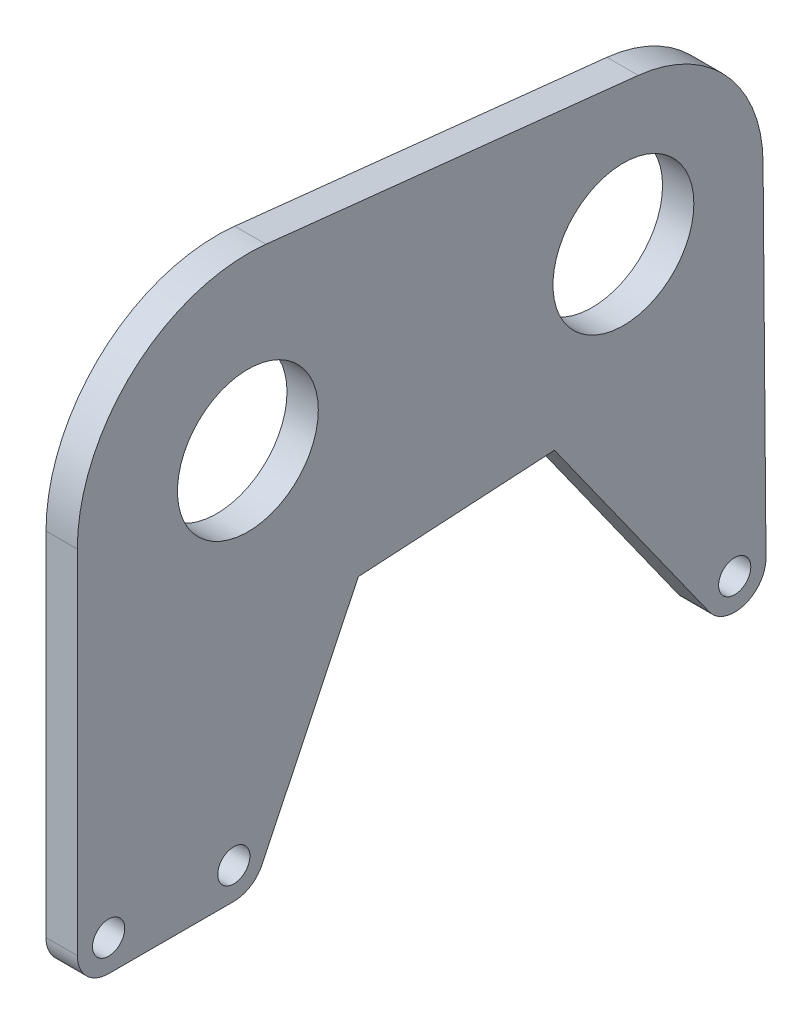
from build123d import *

# Parameters (mm, degrees)
SKETCH2_R           = 34.599541738
SKETCH2_R_2         = 14.2875
SKETCH2_R_3         = 6.35
SKETCH2_R_4         = 3.2639
SKETCH2_R_5         = 28.329529504
BOSS_EXTRUDE2_DEPTH = 6.35


with BuildPart() as part:
    # Sketch2 → Boss-Extrude2 (new body)
    # profile 1 of 10: a face of its own
    with BuildSketch(Plane(origin=(0, 0, 0), x_dir=(0, 0, -1), z_dir=(1, 0, 0))):
        with Locations((54.99261314, -31.75)):
            Circle(SKETCH2_R)
        with Locations((54.99261314, -31.75)):
            Circle(SKETCH2_R_2, mode=Mode.SUBTRACT)
    # profile 2 of 10: a face of its own
    with BuildSketch(Plane(origin=(0, 0, 0), x_dir=(0, 0, -1), z_dir=(1, 0, 0))):
        with BuildLine():
            ThreePointArc((57.000696707, -66.291220141), (31.247618749, -56.915522641), (20.393071403, -31.75))
            Line((20.393071403, -31.75), (20.393071403, -103.183274949))
            ThreePointArc((20.393071403, -103.183274949), (26.743071403, -96.833274949), (33.093071403, -103.183274949))
            ThreePointArc((33.093071403, -103.183274949), (31.233199463, -107.67340301), (26.743071403, -109.533274949))
            Line((26.743071403, -109.533274949), (52.143071403, -109.533274949))
            ThreePointArc((52.143071403, -109.533274949), (47.652943342, -98.693146889), (58.493071403, -103.183274949))
            ThreePointArc((58.493071403, -103.183274949), (58.33576166, -104.587941235), (57.87162656, -105.923011398))
            Line((57.87162656, -105.923011398), (77.392896244, -65.105702067))
            Line((77.392896244, -65.105702067), (57.000696707, -66.291220141))
        make_face()
    # profile 3 of 10: a face of its own
    with BuildSketch(Plane(origin=(0, 0, 0), x_dir=(0, 0, -1), z_dir=(1, 0, 0))):
        with Locations((52.143071403, -103.183274949)):
            Circle(SKETCH2_R_3)
        with Locations((52.143071403, -103.183274949)):
            Circle(SKETCH2_R_4, mode=Mode.SUBTRACT)
    # profile 4 of 10: a face of its own
    with BuildSketch(Plane(origin=(0, 0, 0), x_dir=(0, 0, -1), z_dir=(1, 0, 0))):
        with Locations((26.743071403, -103.183274949)):
            Circle(SKETCH2_R_3)
        with Locations((26.743071403, -103.183274949)):
            Circle(SKETCH2_R_4, mode=Mode.SUBTRACT)
    # profile 5 of 10: a face of its own
    with BuildSketch(Plane(origin=(0, 0, 0), x_dir=(0, 0, -1), z_dir=(1, 0, 0))):
        with Locations((131.170104981, -33.601954858)):
            Circle(SKETCH2_R_5)
        with Locations((131.170104981, -33.601954858)):
            Circle(SKETCH2_R_2, mode=Mode.SUBTRACT)
    # profile 6 of 10: a face of its own
    with BuildSketch(Plane(origin=(0, 0, 0), x_dir=(0, 0, -1), z_dir=(1, 0, 0))):
        with BuildLine():
            Line((134.186655208, -5.433485487), (58.676799121, 2.652835088))
            ThreePointArc((58.676799121, 2.652835088), (80.727797568, -8.623639047), (89.592154878, -31.75))
            ThreePointArc((89.592154878, -31.75), (88.735013932, -39.403670834), (86.206059323, -46.678130018))
            Line((86.206059323, -46.678130018), (77.392896244, -65.105702067))
            Line((77.392896244, -65.105702067), (117.180043235, -62.792642027))
            Line((117.180043235, -62.792642027), (108.094917525, -50.036612316))
            ThreePointArc((108.094917525, -50.036612316), (106.717150914, -19.297575132), (134.186655208, -5.433485487))
        make_face()
    # profile 7 of 10: a face of its own
    with BuildSketch(Plane(origin=(0, 0, 0), x_dir=(0, 0, -1), z_dir=(1, 0, 0))):
        with BuildLine():
            ThreePointArc((86.206059323, -46.678130018), (74.282139722, -60.47355223), (57.000696707, -66.291220141))
            Line((57.000696707, -66.291220141), (77.392896244, -65.105702067))
            Line((77.392896244, -65.105702067), (86.206059323, -46.678130018))
        make_face()
    # profile 8 of 10: a face of its own
    with BuildSketch(Plane(origin=(0, 0, 0), x_dir=(0, 0, -1), z_dir=(1, 0, 0))):
        with BuildLine():
            ThreePointArc((132.814290418, -61.883731609), (118.926309787, -59.149004025), (108.094917525, -50.036612316))
            Line((108.094917525, -50.036612316), (117.180043235, -62.792642027))
            Line((117.180043235, -62.792642027), (132.814290418, -61.883731609))
        make_face()
    # profile 9 of 10: a face of its own
    with BuildSketch(Plane(origin=(0, 0, 0), x_dir=(0, 0, -1), z_dir=(1, 0, 0))):
        with BuildLine():
            Line((160.092841091, -103.129192537), (159.498606986, -33.360674656))
            ThreePointArc((159.498606986, -33.360674656), (159.49937761, -33.481313663), (159.499634486, -33.601954858))
            ThreePointArc((159.499634486, -33.601954858), (151.775216505, -53.043961468), (132.814290418, -61.883731609))
            Line((132.814290418, -61.883731609), (117.180043235, -62.792642027))
            Line((117.180043235, -62.792642027), (148.570820295, -106.867066268))
            ThreePointArc((148.570820295, -106.867066268), (151.78359124, -97.143164231), (160.092841091, -103.129192537))
        make_face()
    # profile 10 of 10: a face of its own
    with BuildSketch(Plane(origin=(0, 0, 0), x_dir=(0, 0, -1), z_dir=(1, 0, 0))):
        with Locations((153.743071403, -103.183274949)):
            Circle(SKETCH2_R_3)
        with Locations((153.743071403, -103.183274949)):
            Circle(SKETCH2_R_4, mode=Mode.SUBTRACT)
    extrude(amount=BOSS_EXTRUDE2_DEPTH)


solid = part.part
